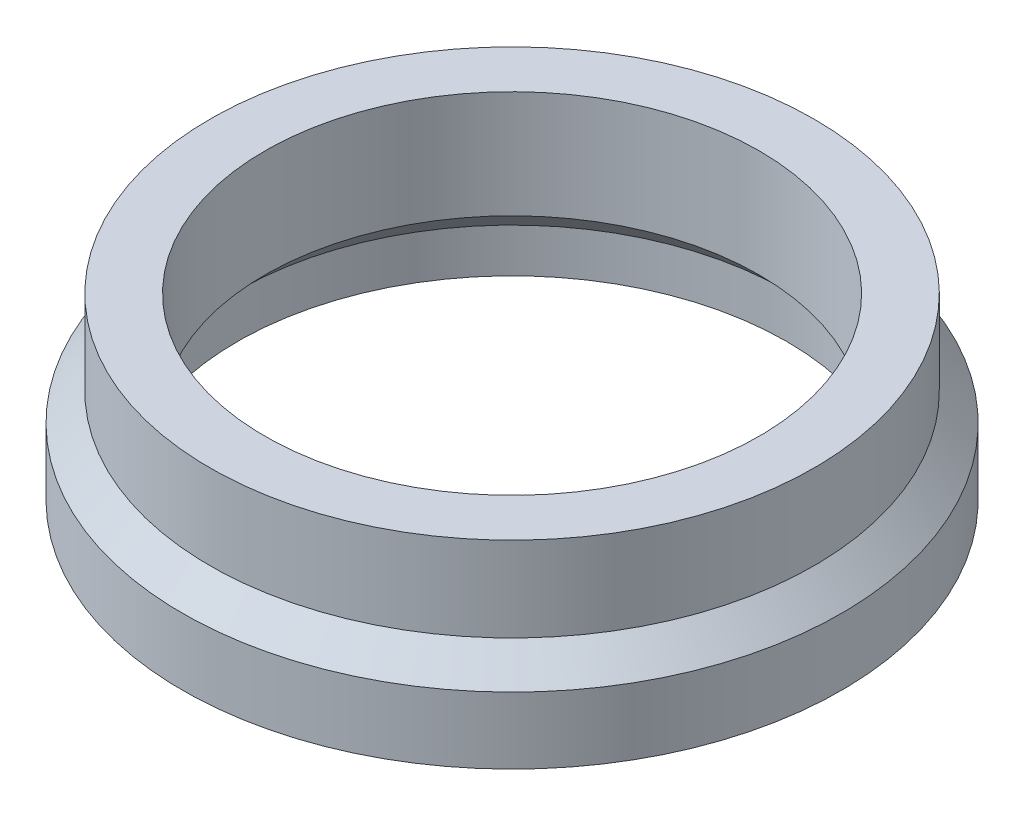
from build123d import *


with BuildPart() as part:
    # Sketch3 → Revolve1 (revolve)
    with BuildSketch(Plane.XY, mode=Mode.PRIVATE) as revolve1_sk:
        Polygon((-6, 0), (-6, 1.214213562), (-5.5, 1.714213562), (-5.5, 3.256387939), (-4.5, 3.256387939), (-4.5, 1.3), (-5, 0.8), (-5, 0), align=None)
    revolve(revolve1_sk.sketch.rotate(Axis((0, 0, 0), (0, 1, 0)), 270), axis=Axis((0, 0, 0), (0, 1, 0)))


solid = part.part
